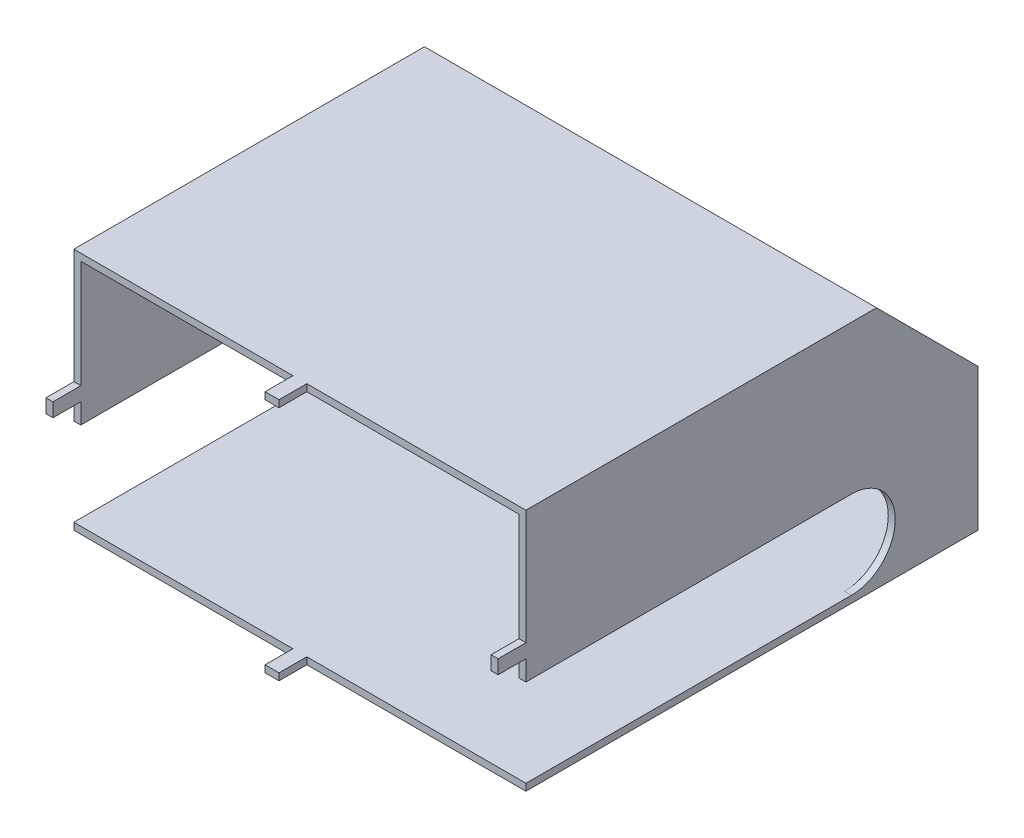
from build123d import *

# Parameters (mm, degrees)
ESQUISSE1_W             = 32.5
ESQUISSE1_H             = 17.5
ESQUISSE1_W_2           = 31.5
ESQUISSE1_H_2           = 16.5
BASE_EXTRUSION_DEPTH    = 32
ESQUISSE3_W             = 0.5
ESQUISSE3_H             = 17.5
BOSS_EXTRU_1_DEPTH      = 32.5
ENL_V_MAT_EXTRU_1_DEPTH = 57.042915794
ESQUISSE5_W             = 1
ESQUISSE5_H             = 0.5
ESQUISSE5_W_2           = 0.5
ESQUISSE5_H_2           = 1
BOSS_EXTRU_2_DEPTH      = 2
ENL_V_MAT_EXTRU_2_DEPTH = 35.693670075
EXTRUSION2_DEPTH        = 32.5


with BuildPart() as part:
    # Esquisse1 → Base-Extrusion (new body)
    with BuildSketch(Plane.XY):
        with Locations((-45.33773679, 23.317248255)):
            Rectangle(ESQUISSE1_W, ESQUISSE1_H)
        with Locations((-45.33773679, 23.317248255)):
            Rectangle(ESQUISSE1_W_2, ESQUISSE1_H_2, mode=Mode.SUBTRACT)
    extrude(amount=-BASE_EXTRUSION_DEPTH)

    # Esquisse3 → Boss.-Extru.1 (add)
    with BuildSketch(Plane.ZY.offset(61.58773679)):
        with Locations((-32.25, 23.317248255)):
            Rectangle(ESQUISSE3_W, ESQUISSE3_H)
    extrude(amount=-BOSS_EXTRU_1_DEPTH)

    # Esquisse4 → Enlèv. mat.-Extru.1 (cut, through all)
    with BuildSketch(Plane.ZY.offset(61.58773679)):
        with BuildLine():
            Line((-23.4, 15.067248255), (0.817293984, 15.067248255))
            Line((0.817293984, 15.067248255), (0.817293984, 21.367248255))
            Line((0.817293984, 21.367248255), (-23.4, 21.367248255))
            ThreePointArc((-23.4, 21.367248255), (-26.55, 18.217248255), (-23.4, 15.067248255))
        make_face()
    extrude(amount=-ENL_V_MAT_EXTRU_1_DEPTH, mode=Mode.SUBTRACT)

    # Esquisse5 → Boss.-Extru.2 (add)
    with BuildSketch(Plane.XY):
        with Locations((-45.33773679, 14.817248255)):
            Rectangle(ESQUISSE5_W, ESQUISSE5_H)
        with Locations((-29.33773679, 23.317248255)):
            Rectangle(ESQUISSE5_W_2, ESQUISSE5_H_2)
        with Locations((-45.33773679, 31.817248255)):
            Rectangle(ESQUISSE5_W, ESQUISSE5_H)
        with Locations((-61.33773679, 23.317248255)):
            Rectangle(ESQUISSE5_W_2, ESQUISSE5_H_2)
    extrude(amount=BOSS_EXTRU_2_DEPTH)

    # Esquisse6 → Enlèv. mat.-Extru.2 (cut)
    with BuildSketch(Plane.ZY.offset(61.58773679)):
        Polygon((-41.526935662, 26.437225615), (-29.203507462, 38.760653816), (-23.505050951, 33.062197305), (-35.828479151, 20.738769104), align=None)
    extrude(amount=-ENL_V_MAT_EXTRU_2_DEPTH, mode=Mode.SUBTRACT)

    # Esquisse7 → Extrusion2 (add)
    with BuildSketch(Plane.ZY.offset(61.58773679)):
        Polygon((-32.5, 24.067248255), (-24.5, 32.067248255), (-25.207106781, 32.067248255), (-32.5, 24.774355036), align=None)
    extrude(amount=-EXTRUSION2_DEPTH)


solid = part.part
